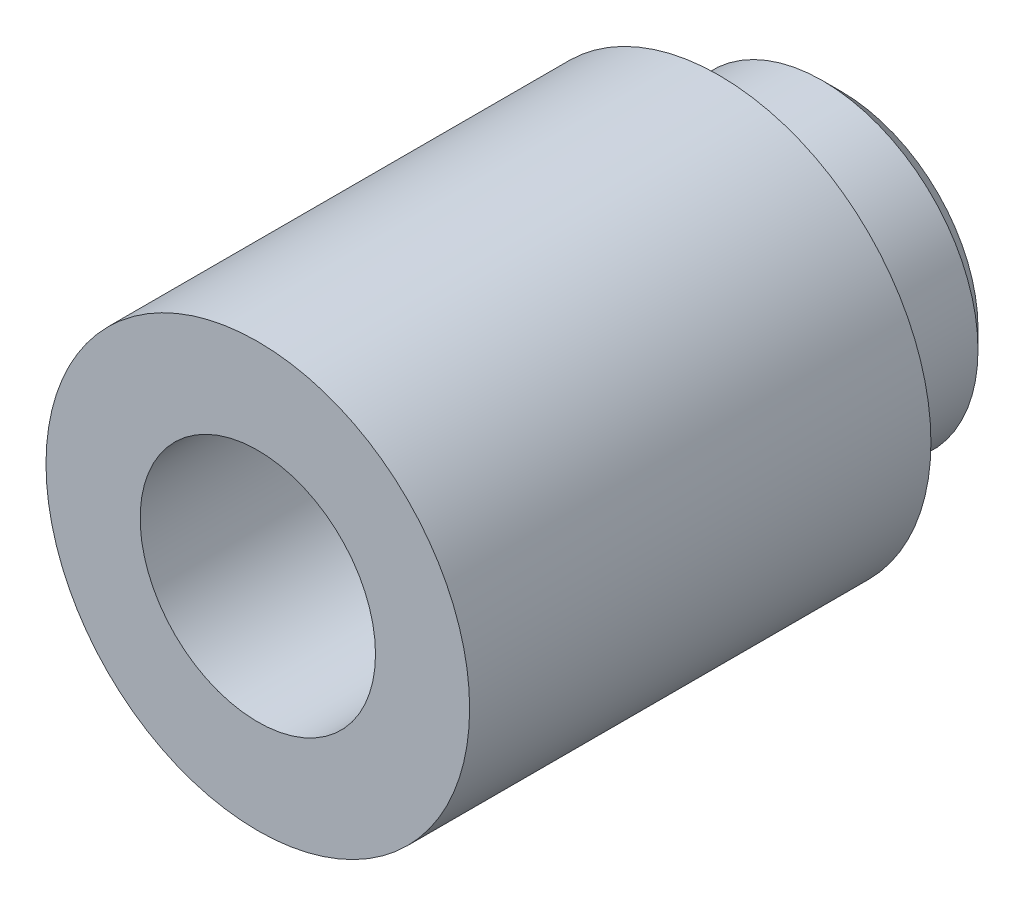
from build123d import *

# Parameters (mm, degrees)
SKETCH1_R           = 2.25
BOSS_EXTRUDE1_DEPTH = 6.2
SKETCH2_OUTSIDE_W   = 8.276
SKETCH2_OUTSIDE_H   = 8.276
SKETCH2_OUTSIDE_R   = 1.65
CUT_EXTRUDE1_DEPTH  = 1.3
SKETCH3_R           = 1.25
CUT_EXTRUDE2_DEPTH  = 7.968859304
CHAMFER1_SIZE       = 0.2


with BuildPart() as part:
    # Sketch1 → Boss-Extrude1 (new body)
    with BuildSketch(Plane.XY):
        Circle(SKETCH1_R)
    extrude(amount=-BOSS_EXTRUDE1_DEPTH)

    # Sketch2 outside → Cut-Extrude1 (cut)
    with BuildSketch(Plane(origin=(0, 0, -6.2), x_dir=(-1, 0, 0), z_dir=(0, 0, -1))):
        Rectangle(SKETCH2_OUTSIDE_W, SKETCH2_OUTSIDE_H)
        Circle(SKETCH2_OUTSIDE_R, mode=Mode.SUBTRACT)
    extrude(amount=-CUT_EXTRUDE1_DEPTH, mode=Mode.SUBTRACT)

    # Sketch3 → Cut-Extrude2 (cut, through all)
    with BuildSketch(Plane.XY):
        Circle(SKETCH3_R)
    extrude(amount=-CUT_EXTRUDE2_DEPTH, mode=Mode.SUBTRACT)

    # Chamfer1
    chamfer1_edges = [part.edges().sort_by_distance(p)[0] for p in [
        (1.65, 0, -6.2),
    ]]
    chamfer(chamfer1_edges, length=CHAMFER1_SIZE)


solid = part.part
